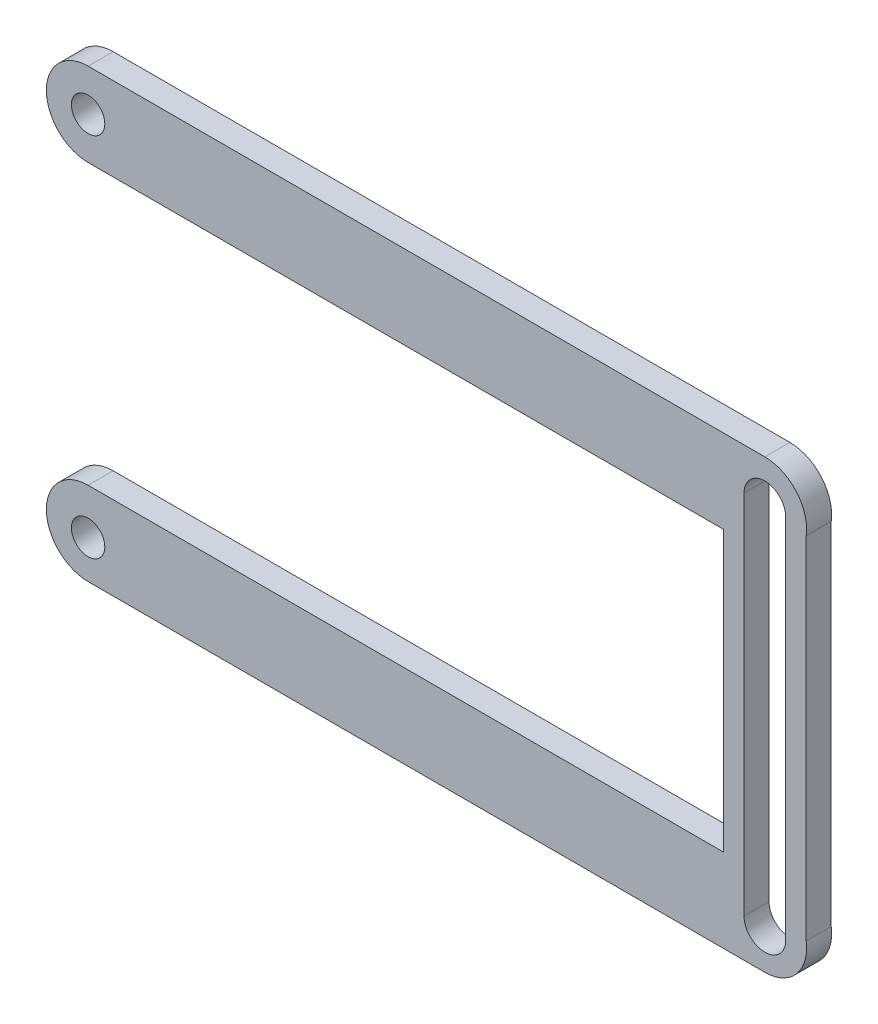
from build123d import *

# Parameters (mm, degrees)
SKETCH_1_R          = 2
EXTRUDE_1_DEPTH     = 3
SKETCH_6_R          = 2
CUT_EXTRUDE_1_DEPTH = 6
CUT_EXTRUDE_2_DEPTH = 6


with BuildPart() as part:
    # 草图1 → 凸台-拉伸1 (new body)
    with BuildSketch(Plane.XY):
        with BuildLine():
            Line((30.750249224, 24.910133645), (-50.336395226, 24.910133645))
            ThreePointArc((-50.336395226, 24.910133645), (-55.336395226, 19.910133645), (-50.336395226, 14.910133645))
            Line((-50.336395226, 14.910133645), (25.802071198, 14.910133645))
            Line((25.802071198, 14.910133645), (25.802071198, -18.575080464))
            Line((25.802071198, -18.575080464), (-50.336395226, -18.575080464))
            ThreePointArc((-50.336395226, -18.575080464), (-55.336395226, -23.575080464), (-50.336395226, -28.575080464))
            Line((-50.336395226, -28.575080464), (30.750249224, -28.575080464))
            ThreePointArc((30.750249224, -28.575080464), (34.531124493, -26.846927374), (35.69842725, -22.857073344))
            Line((35.69842725, -22.857073344), (35.69842725, 19.192126526))
            ThreePointArc((35.69842725, 19.192126526), (34.531124493, 23.181980555), (30.750249224, 24.910133645))
        make_face()
        with Locations((-50.336395226, 19.910133645)):
            Circle(SKETCH_1_R, mode=Mode.SUBTRACT)
    extrude(amount=-EXTRUDE_1_DEPTH)

    # 草图6 → 切除-拉伸1 (cut)
    with BuildSketch(Plane.XY):
        with Locations((-50.336395226, -23.991463112)):
            Circle(SKETCH_6_R)
    extrude(amount=-CUT_EXTRUDE_1_DEPTH, mode=Mode.SUBTRACT)

    # 草图13 → 切除-拉伸2 (cut)
    with BuildSketch(Plane.XY):
        with BuildLine():
            Line((33.24842725, 19.910133645), (33.24842725, -23.991463112))
            ThreePointArc((33.24842725, -23.991463112), (30.750249224, -26.489641138), (28.252071198, -23.991463112))
            Line((28.252071198, -23.991463112), (28.252071198, 19.910133645))
            ThreePointArc((28.252071198, 19.910133645), (30.750249224, 22.408311671), (33.24842725, 19.910133645))
        make_face()
    extrude(amount=-CUT_EXTRUDE_2_DEPTH, mode=Mode.SUBTRACT)


solid = part.part
